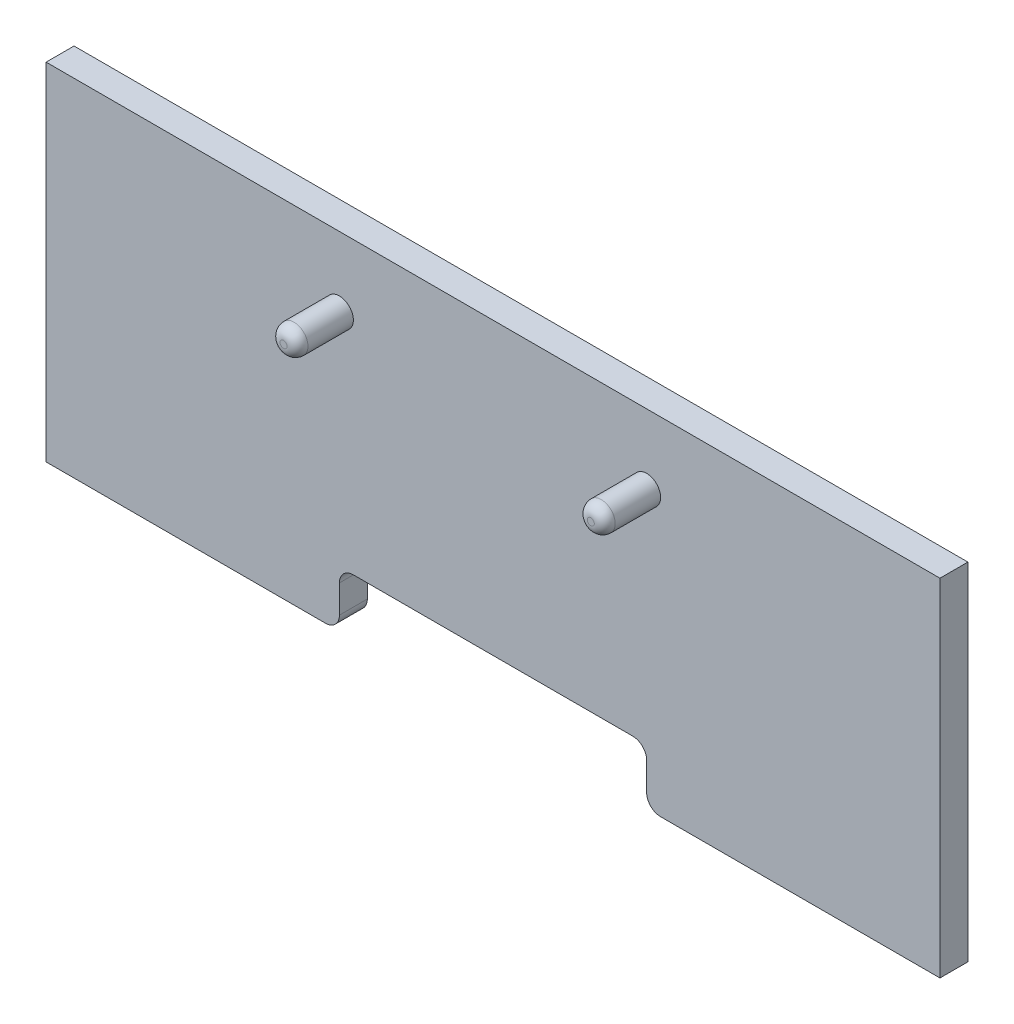
from build123d import *

# Parameters (mm, degrees)
SKETCH1_W           = 203.2
SKETCH1_H           = 78.7146
BOSS_EXTRUDE1_DEPTH = 6.35
SKETCH2_W           = 69.85
SKETCH2_H           = 12.7
CUT_EXTRUDE1_DEPTH  = 219.005850273
FILLET1_R           = 3.175
SKETCH3_R           = 3.175
BOSS_EXTRUDE2_DEPTH = 12.7
FILLET2_R           = 2.38125


with BuildPart() as part:
    # Sketch1 → Boss-Extrude1 (new body)
    with BuildSketch(Plane.XY):
        with Locations((101.6, 39.3573)):
            Rectangle(SKETCH1_W, SKETCH1_H)
    extrude(amount=BOSS_EXTRUDE1_DEPTH)

    # Sketch2 → Cut-Extrude1 (cut, through all)
    with BuildSketch(Plane.XY.offset(6.35)):
        with Locations((101.6, 6.35)):
            Rectangle(SKETCH2_W, SKETCH2_H)
    extrude(amount=-CUT_EXTRUDE1_DEPTH, mode=Mode.SUBTRACT)

    # Fillet1
    fillet1_edges = [part.edges().sort_by_distance(p)[0] for p in [
        (66.675, 0, 3.175),
        (66.675, 12.7, 3.175),
        (136.525, 12.7, 3.175),
        (136.525, 0, 3.175),
    ]]
    fillet(fillet1_edges, radius=FILLET1_R)

    # Sketch3 → Boss-Extrude2 (add)
    with BuildSketch(Plane.XY.offset(6.35)):
        with Locations(Location((66.675, 62.8396, 0), (0, 0, 180))):
            Circle(SKETCH3_R)
        with Locations(Location((136.525, 62.8396, 0), (0, 0, 180))):
            Circle(SKETCH3_R)
    extrude(amount=BOSS_EXTRUDE2_DEPTH)

    # Fillet2
    fillet2_edges = [part.edges().sort_by_distance(p)[0] for p in [
        (69.85, 62.8396, 19.05),
        (139.7, 62.8396, 19.05),
    ]]
    fillet(fillet2_edges, radius=FILLET2_R)


solid = part.part
